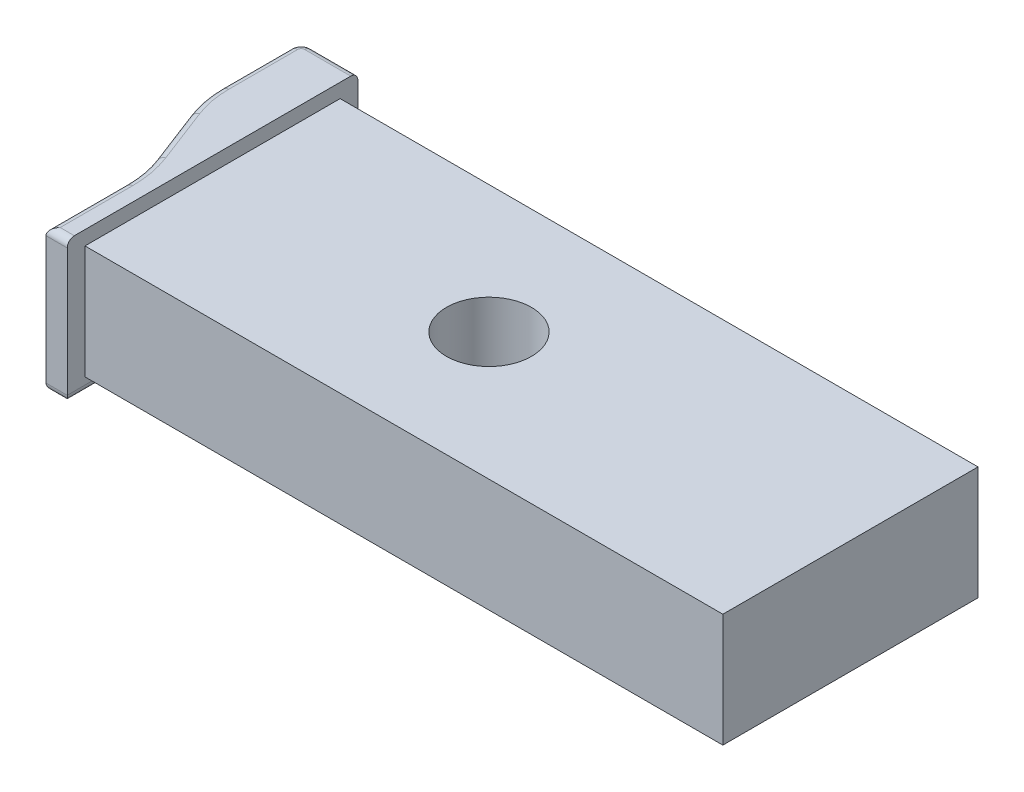
from build123d import *

# Parameters (mm, degrees)
SKETCH_1_W      = 90
SKETCH_1_H      = 36
SKETCH_1_R      = 6
EXTRUDE_1_DEPTH = 16
EXTRUDE_2_DEPTH = 20
FILLET_1_R      = 1
FILLET_2_R      = 1


with BuildPart() as part:
    # Эскиз1 → Бобышка-Вытянуть1 (new body)
    with BuildSketch(Plane(origin=(0, 0, 0), x_dir=(1, 0, 0), z_dir=(0, 1, 0))):
        Rectangle(SKETCH_1_W, SKETCH_1_H)
        with Locations(Location((-6, 0, 0), (0, 0, 270))):
            Circle(SKETCH_1_R, mode=Mode.SUBTRACT)
    extrude(amount=EXTRUDE_1_DEPTH)

    # Эскиз3 → Бобышка-Вытянуть2 (add)
    with BuildSketch(Plane(origin=(0, 18, 0), x_dir=(1, 0, 0), z_dir=(0, 1, 0))):
        with BuildLine():
            Line((-45, 20.5), (-45, -20.5))
            Line((-45, -20.5), (-48, -20.5))
            Line((-48, -20.5), (-48, -9.285164832))
            ThreePointArc((-48, -9.285164832), (-48.252071986, -6.546804135), (-48.999815907, -3.900478642))
            Line((-48.999815907, -3.900478642), (-52.000184093, 3.900478642))
            ThreePointArc((-52.000184093, 3.900478642), (-52.747928014, 6.546804135), (-53, 9.285164832))
            Line((-53, 9.285164832), (-53, 19))
            ThreePointArc((-53, 19), (-52.560660172, 20.060660172), (-51.5, 20.5))
            Line((-51.5, 20.5), (-45, 20.5))
        make_face()
    extrude(amount=-EXTRUDE_2_DEPTH)

    # Скругление1
    fillet_1_edges = [part.edges().sort_by_distance(p)[0] for p in [
        (-48.25, 18, -20.5),
        (-52.560660172, 18, -20.060660172),
        (-53, 18, -14.142582416),
        (-52.747928014, 18, -6.546804135),
        (-50.5, 18, 0),
        (-48.252071986, 18, 6.546804135),
        (-48, 18, 14.892582416),
        (-46.5, 18, 20.5),
    ]]
    fillet(fillet_1_edges, radius=FILLET_1_R)

    # Скругление2
    fillet_2_edges = [part.edges().sort_by_distance(p)[0] for p in [
        (-45, -2, 0),
        (-48.25, -2, -20.5),
        (-46.5, -2, 20.5),
        (-48, -2, 14.892582416),
        (-48.252071986, -2, 6.546804135),
        (-50.5, -2, 0),
        (-52.747928014, -2, -6.546804135),
        (-53, -2, -14.142582416),
        (-52.560660172, -2, -20.060660172),
    ]]
    fillet(fillet_2_edges, radius=FILLET_2_R)


solid = part.part
